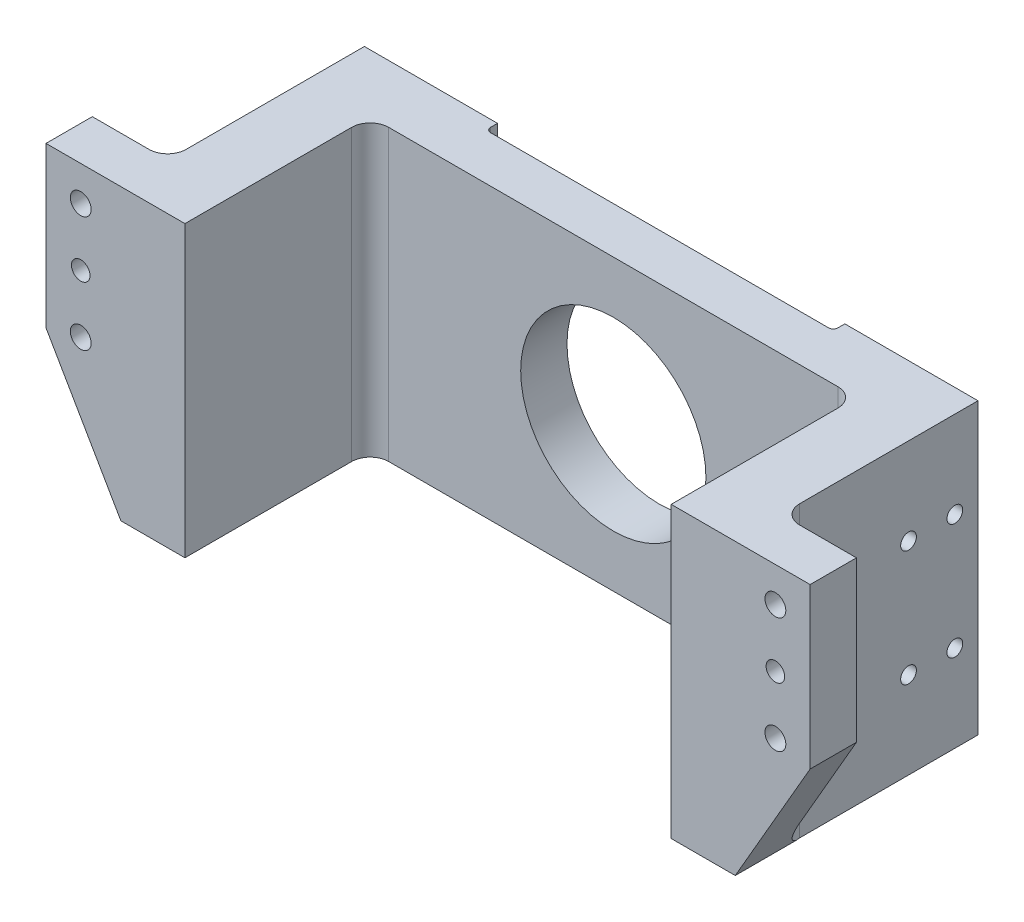
from build123d import *
from OCP.BRepFilletAPI import BRepFilletAPI_MakeChamfer

# Parameters (mm, degrees)
SKETCH_1_W                = 265
SKETCH_1_H                = 125
EXTRUDE_1_DEPTH           = 85
SKETCH_2_W                = 330
SKETCH_2_H                = 125
EXTRUDE_2_DEPTH           = 20
SKETCH_3_W                = 150
SKETCH_3_H                = 125
CUT_EXTRUDE_1_DEPTH       = 5
SKETCH_4_R                = 40
CUT_EXTRUDE_2_DEPTH       = 206.319872394
SKETCH_5_W                = 210
SKETCH_5_H                = 125
CUT_EXTRUDE_3_DEPTH       = 80
CHAMFER_2_SIZE            = 56
CHAMFER_2_SIZE2           = 32.331615075
SKETCH_10_R               = 4.5
SKETCH_10_R_2             = 4
CUT_EXTRUDE_4_DEPTH       = 196.847517217
HOLE_WIZARD_M16_1_D       = 14
HOLE_WIZARD_M16_1_DEPTH   = 20
HOLE_WIZARD_M16_1_TIP     = 4.206024333
CHAMFER_3_SIZE            = 1
HOLE_WIZARD_1_D           = 9
HOLE_WIZARD_1_CBORE_D     = 15
HOLE_WIZARD_1_CBORE_DEPTH = 9
HOLE_WIZARD_M8_1_D        = 6.8
HOLE_WIZARD_M8_1_DEPTH    = 22.25
HOLE_WIZARD_M8_1_TIP      = 2.042926105
FILLET_1_R                = 8
FILLET_2_R                = 2


with BuildPart() as part:
    # 草图1 → 凸台-拉伸1 (new body)
    with BuildSketch(Plane.XY):
        Rectangle(SKETCH_1_W, SKETCH_1_H)
    extrude(amount=EXTRUDE_1_DEPTH)

    # 草图2 → 凸台-拉伸2 (add)
    with BuildSketch(Plane.XY.offset(85)):
        Rectangle(SKETCH_2_W, SKETCH_2_H)
    extrude(amount=EXTRUDE_2_DEPTH)

    # 草图3 → 切除-拉伸1 (cut)
    with BuildSketch(Plane(origin=(0, 0, 0), x_dir=(-1, 0, 0), z_dir=(0, 0, -1))):
        Rectangle(SKETCH_3_W, SKETCH_3_H)
    extrude(amount=-CUT_EXTRUDE_1_DEPTH, mode=Mode.SUBTRACT)

    # 草图4 → 切除-拉伸2 (cut, through all)
    with BuildSketch(Plane(origin=(0, 0, 0), x_dir=(-1, 0, 0), z_dir=(0, 0, -1))):
        Circle(SKETCH_4_R)
    extrude(amount=-CUT_EXTRUDE_2_DEPTH, mode=Mode.SUBTRACT)

    # 草图5 → 切除-拉伸3 (cut)
    with BuildSketch(Plane.XY.offset(105)):
        Rectangle(SKETCH_5_W, SKETCH_5_H)
    extrude(amount=-CUT_EXTRUDE_3_DEPTH, mode=Mode.SUBTRACT)

    # 倒角2: one chamfer whose edges measure the first distance from different faces: ONE call of the kernel's chamfer builder (chamfer() names one face for all edges)
    chamfer_2_edges_1 = [part.edges().sort_by_distance(p)[0] for p in [
        (165, -62.5, 95),
    ]]
    chamfer_2_side_1 = [part.faces().sort_by_distance(p)[0] for p in [
        (165, 0, 95),
    ]]
    chamfer_2_edges_2 = [part.edges().sort_by_distance(p)[0] for p in [
        (-165, -62.5, 95),
    ]]
    chamfer_2_side_2 = [part.faces().sort_by_distance(p)[0] for p in [
        (-165, 0, 95),
    ]]
    chamfer_2 = BRepFilletAPI_MakeChamfer(part.part.solid().wrapped)
    for e in chamfer_2_edges_1:
        chamfer_2.Add(CHAMFER_2_SIZE, CHAMFER_2_SIZE2, e.wrapped, chamfer_2_side_1[0].wrapped)  # the first distance lies on this face
    for e in chamfer_2_edges_2:
        chamfer_2.Add(CHAMFER_2_SIZE, CHAMFER_2_SIZE2, e.wrapped, chamfer_2_side_2[0].wrapped)  # the first distance lies on this face
    add(Compound.cast(chamfer_2.Shape()), mode=Mode.REPLACE)

    # 草图10 → 切除-拉伸4 (cut, through all)
    with BuildSketch(Plane(origin=(0, 0, 85), x_dir=(-1, 0, 0), z_dir=(0, 0, -1))):
        with Locations((-150, 47.5)):
            Circle(SKETCH_10_R)
        with Locations((-150, -2.5)):
            Circle(SKETCH_10_R)
        with Locations((-150, 22.5)):
            Circle(SKETCH_10_R_2)
    cut_extrude_4 = extrude(amount=-CUT_EXTRUDE_4_DEPTH, mode=Mode.SUBTRACT)

    # M16 螺纹孔1
    with Locations(Plane(origin=(0, 0, 0), x_dir=(-1, 0, 0), z_dir=(0, 0, -1))):
        with Locations((105, 0), (-105, 0)):
            Hole(HOLE_WIZARD_M16_1_D / 2, depth=HOLE_WIZARD_M16_1_DEPTH)
            with Locations((0, 0, -(HOLE_WIZARD_M16_1_DEPTH + HOLE_WIZARD_M16_1_TIP / 2))):  # 118° drill point
                Cone(0, HOLE_WIZARD_M16_1_D / 2, HOLE_WIZARD_M16_1_TIP, mode=Mode.SUBTRACT)

    # 镜向1: 切除-拉伸4 across plane
    add(cut_extrude_4.mirror(Plane.ZY), mode=Mode.SUBTRACT)

    # 倒角3
    chamfer_3_edges = [part.edges().sort_by_distance(p)[0] for p in [
        (-154, 22.5, 85),
        (154, 22.5, 85),
    ]]
    chamfer(chamfer_3_edges, length=CHAMFER_3_SIZE)

    # 打孔尺寸根据内六角圆柱头螺钉的类型1 (through all)
    with Locations(Plane(origin=(0, 0, 85), x_dir=(-1, 0, 0), z_dir=(0, 0, -1))):
        with Locations((150, -2.5), (150, 47.5), (-150, -2.5), (-150, 47.5)):
            CounterBoreHole(HOLE_WIZARD_1_D / 2, HOLE_WIZARD_1_CBORE_D / 2, HOLE_WIZARD_1_CBORE_DEPTH)

    # M8 螺纹孔1
    with Locations(Plane(origin=(132.5, 0, 0), x_dir=(0, 0, -1), z_dir=(1, 0, 0))):
        with Locations((-10, 25), (-30, 25), (-30, -25), (-10, -25)):
            Hole(HOLE_WIZARD_M8_1_D / 2, depth=HOLE_WIZARD_M8_1_DEPTH)
            with Locations((0, 0, -(HOLE_WIZARD_M8_1_DEPTH + HOLE_WIZARD_M8_1_TIP / 2))):  # 118° drill point
                Cone(0, HOLE_WIZARD_M8_1_D / 2, HOLE_WIZARD_M8_1_TIP, mode=Mode.SUBTRACT)

    # 圆角1
    fillet_1_edges = [part.edges().sort_by_distance(p)[0] for p in [
        (132.5, 0, 85),
        (-132.5, 0, 85),
        (105, 0, 25),
        (-105, 0, 25),
    ]]
    fillet(fillet_1_edges, radius=FILLET_1_R)

    # 圆角2
    fillet_2_edges = [part.edges().sort_by_distance(p)[0] for p in [
        (75, 0, 5),
        (-75, 0, 5),
    ]]
    fillet(fillet_2_edges, radius=FILLET_2_R)


solid = part.part
